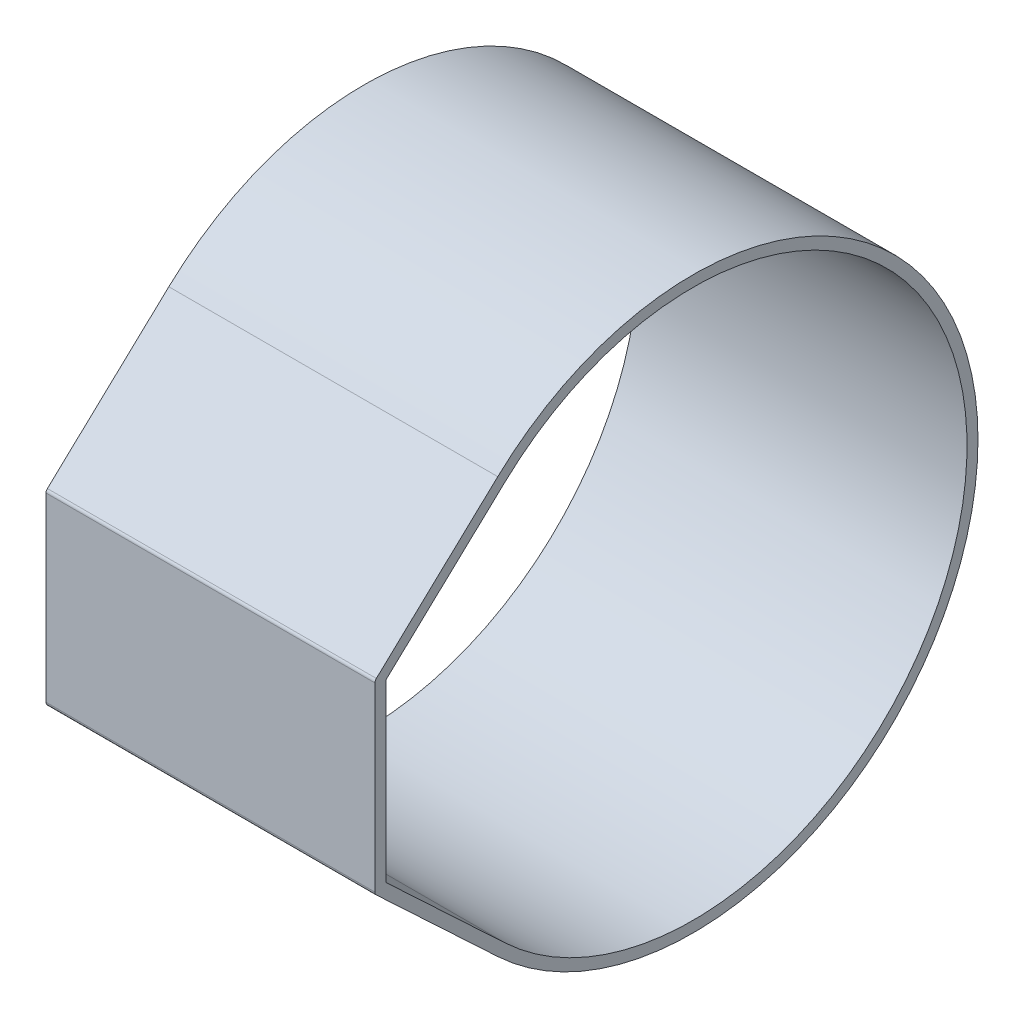
from build123d import *

# Parameters (mm, degrees)
BOSS_EXTRUDE1_DEPTH = 15


with BuildPart() as part:
    # Sketch1 → Boss-Extrude1 (new body)
    with BuildSketch(Plane(origin=(-154.007123162, 0, 0), x_dir=(0, -1, 0), z_dir=(-1, 0, 0))):
        with BuildLine():
            Line((-657.855975533, -377.458039896), (-663.056416627, -371.920825161))
            ThreePointArc((-663.056416627, -371.920825161), (-663.122777957, -371.874190277), (-663.202201808, -371.857743681))
            Line((-663.202201808, -371.857743681), (-671.461822765, -371.857743681))
            ThreePointArc((-671.461822765, -371.857743681), (-671.541246615, -371.874190277), (-671.607607945, -371.920825161))
            Line((-671.607607945, -371.920825161), (-676.808049039, -377.458039896))
            ThreePointArc((-676.808049039, -377.458039896), (-667.332012286, -399.357743681), (-657.855975533, -377.458039896))
        make_face()
        with BuildLine():
            Line((-676.443586087, -377.800336196), (-671.332012286, -372.357743681))
            Line((-671.332012286, -372.357743681), (-663.332012286, -372.357743681))
            Line((-663.332012286, -372.357743681), (-658.220438485, -377.800336196))
            ThreePointArc((-658.220438485, -377.800336196), (-667.332012286, -398.857743681), (-676.443586087, -377.800336196))
        make_face(mode=Mode.SUBTRACT)
    extrude(amount=-BOSS_EXTRUDE1_DEPTH)


solid = part.part
